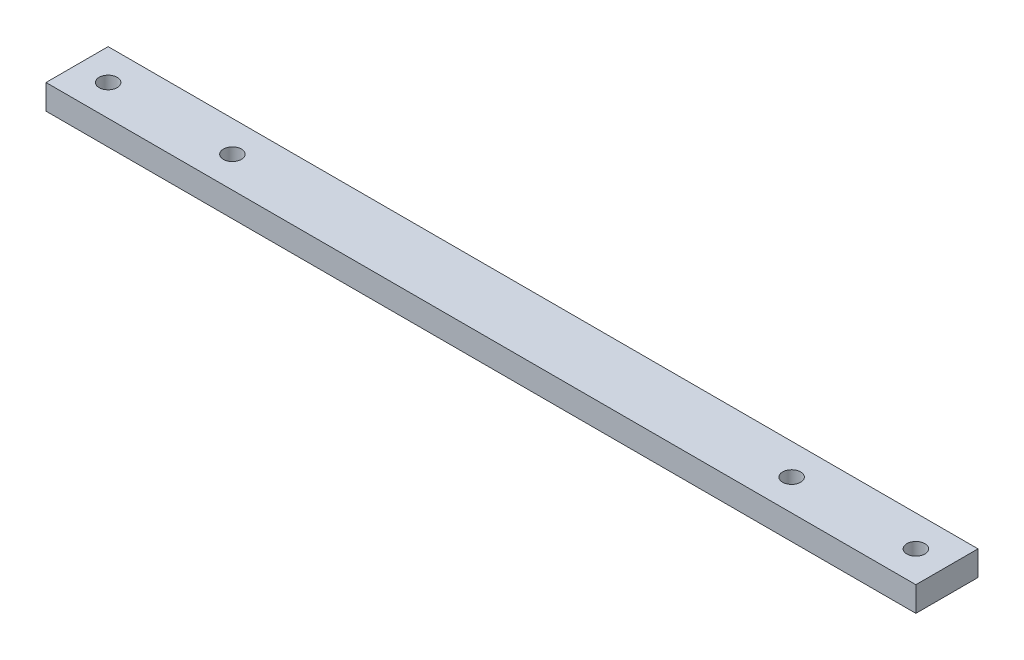
from build123d import *

# Parameters (mm, degrees)
SKETCH1_W              = 140
SKETCH1_H              = 10
BOSS_EXTRUDE1_DEPTH    = 4
M2_5_CLEARANCE_HOLE1_D = 2.9


with BuildPart() as part:
    # Sketch1 → Boss-Extrude1 (new body)
    with BuildSketch(Plane(origin=(0, 0, 0), x_dir=(1, 0, 0), z_dir=(0, 1, 0))):
        Rectangle(SKETCH1_W, SKETCH1_H)
    extrude(amount=BOSS_EXTRUDE1_DEPTH)

    # M2.5 Clearance Hole1 (through all)
    with Locations(Plane(origin=(0, 4, 0), x_dir=(1, 0, 0), z_dir=(0, 1, 0))):
        with Locations((-65, 0), (65, 0), (-45, 0), (45, 0)):
            Hole(M2_5_CLEARANCE_HOLE1_D / 2)


solid = part.part
